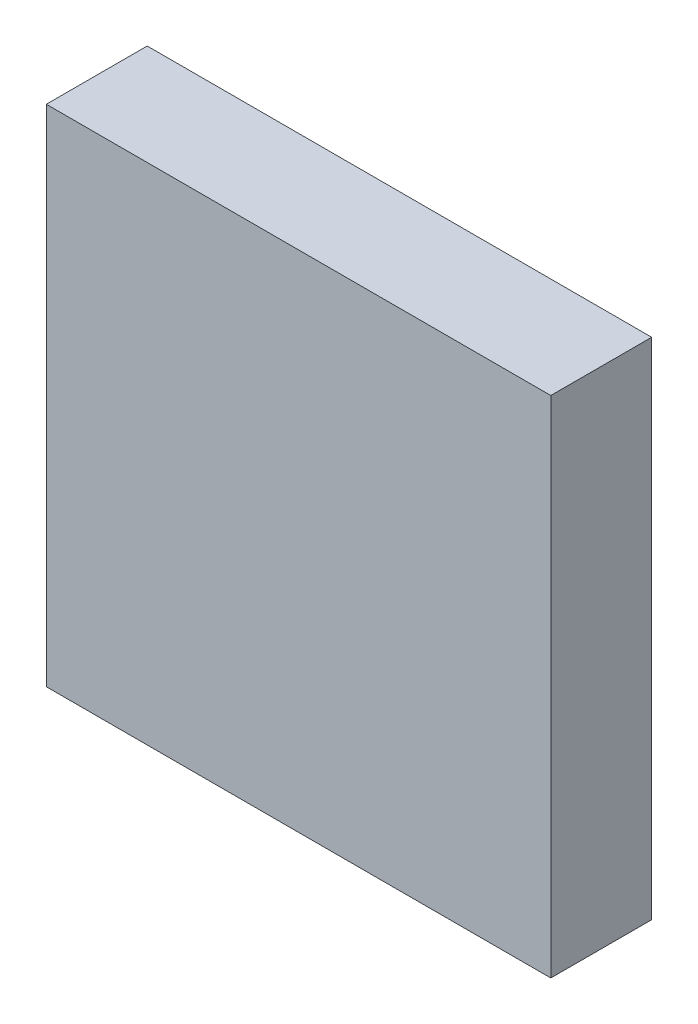
from build123d import *

# Parameters (mm, degrees)
SKETCH1_W           = 25
SKETCH1_H           = 25
BOSS_EXTRUDE1_DEPTH = 5


with BuildPart() as part:
    # Sketch1 → Boss-Extrude1 (new body)
    with BuildSketch(Plane.XY):
        with Locations((12.5, -12.5)):
            Rectangle(SKETCH1_W, SKETCH1_H)
    extrude(amount=BOSS_EXTRUDE1_DEPTH)


solid = part.part
